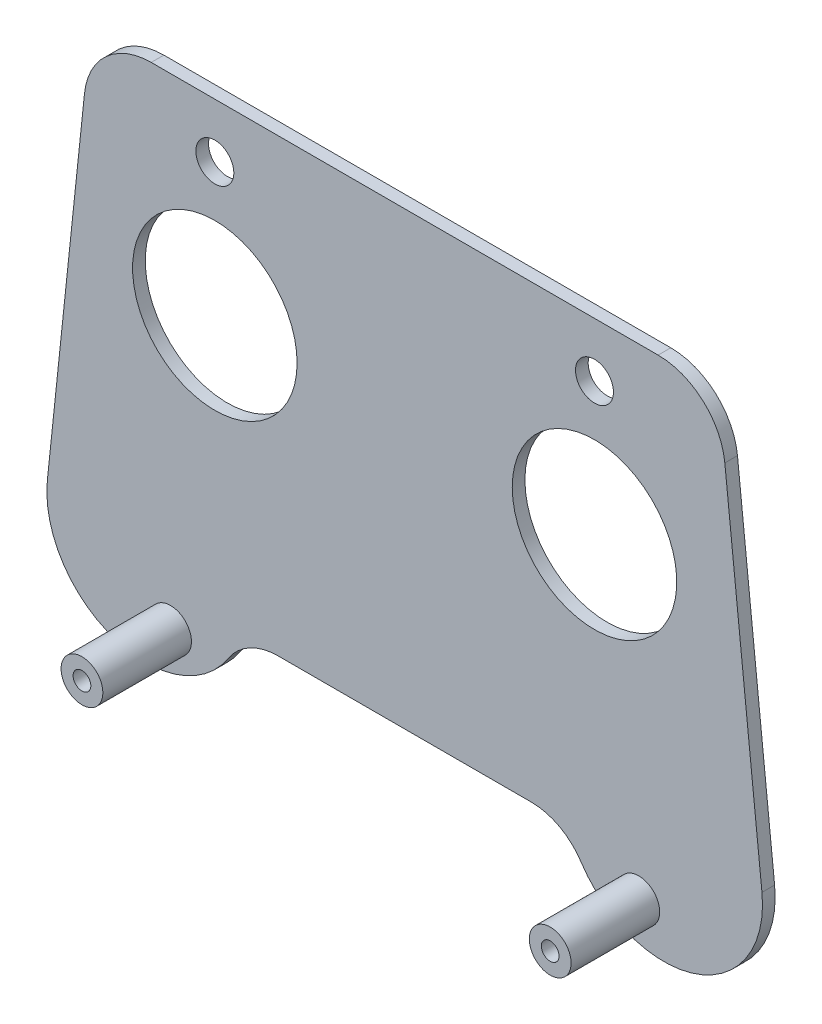
from build123d import *

# Parameters (mm, degrees)
SKETCH1_R           = 13
SKETCH1_R_2         = 3
BOSS_EXTRUDE1_DEPTH = 2
SKETCH2_R           = 3.3
BOSS_EXTRUDE2_DEPTH = 14
SKETCH3_R           = 1.4
CUT_EXTRUDE1_DEPTH  = 10


with BuildPart() as part:
    # Sketch1 → Boss-Extrude1 (new body)
    with BuildSketch(Plane.XY):
        with BuildLine():
            Line((30.587032828, 29.429180606), (-49.522529265, 29.429180606))
            ThreePointArc((-49.522529265, 29.429180606), (-56.615313692, 26.706515756), (-60.064461355, 19.937182317))
            Line((-60.064461355, 19.937182317), (-65.933159759, -35.899753171))
            ThreePointArc((-65.933159759, -35.899753171), (-55.634580371, -52.232565016), (-37.345276376, -46.042020648))
            ThreePointArc((-37.345276376, -46.042020648), (-33.948223744, -42.907324122), (-29.467749897, -41.770819394))
            Line((-29.467749897, -41.770819394), (10.53225346, -41.770819394))
            ThreePointArc((10.53225346, -41.770819394), (15.012727307, -42.907324122), (18.409779939, -46.042020648))
            ThreePointArc((18.409779939, -46.042020648), (36.699083934, -52.232565016), (46.997663323, -35.899753171))
            Line((46.997663323, -35.899753171), (41.128964919, 19.937182317))
            ThreePointArc((41.128964919, 19.937182317), (37.679817255, 26.706515756), (30.587032828, 29.429180606))
        make_face()
        with Locations((-39.467748218, -0.170819394)):
            Circle(SKETCH1_R, mode=Mode.SUBTRACT)
        with Locations(Location((20.532251782, -0.170819394, 0), (0, 0, 180))):
            Circle(SKETCH1_R, mode=Mode.SUBTRACT)
        with Locations((-39.467748218, 20.829180606)):
            Circle(SKETCH1_R_2, mode=Mode.SUBTRACT)
        with Locations(Location((20.532251782, 20.829180606, 0), (0, 0, 180))):
            Circle(SKETCH1_R_2, mode=Mode.SUBTRACT)
    extrude(amount=BOSS_EXTRUDE1_DEPTH)

    # Sketch2 → Boss-Extrude2 (add)
    with BuildSketch(Plane.XY.offset(2)):
        with Locations((-46.467748218, -46.670819394)):
            Circle(SKETCH2_R)
        with Locations(Location((27.532251782, -46.670819394, 0), (0, 0, 180))):
            Circle(SKETCH2_R)
    extrude(amount=BOSS_EXTRUDE2_DEPTH)

    # Sketch3 → Cut-Extrude1 (cut)
    with BuildSketch(Plane.XY.offset(16)):
        with Locations((-46.467748218, -46.670819394)):
            Circle(SKETCH3_R)
        with Locations(Location((27.532251782, -46.670819394, 0), (0, 0, 180))):
            Circle(SKETCH3_R)
    extrude(amount=-CUT_EXTRUDE1_DEPTH, mode=Mode.SUBTRACT)


solid = part.part
